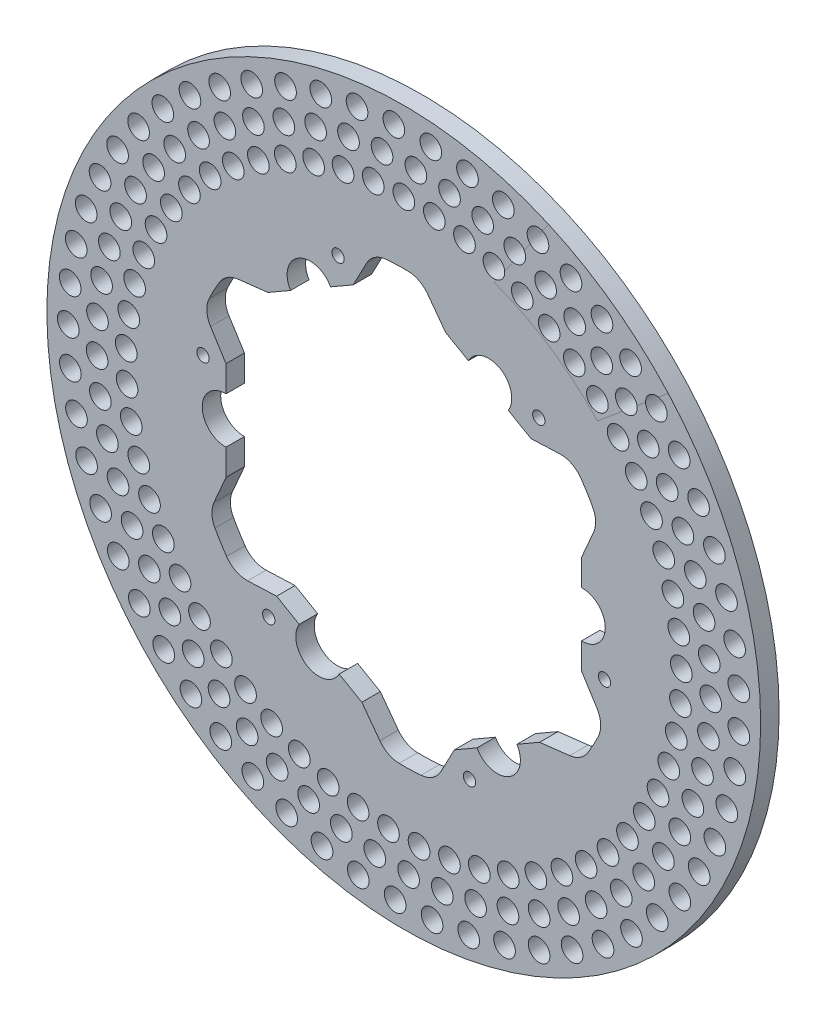
from build123d import *

# Parameters (mm, degrees)
SKETCH1_R           = 92.075
BOSS_EXTRUDE1_DEPTH = 4.7625
FILLET1_R           = 6.35
SKETCH4_R           = 1.5875
CUT_EXTRUDE1_DEPTH  = 131.30077765
SKETCH5_R           = 2.794
CUT_EXTRUDE2_DEPTH  = 131.30077765
CIRPATTERN1_COUNT   = 57


with BuildPart() as part:
    # Sketch1 → Boss-Extrude1 (new body)
    with BuildSketch(Plane.XY):
        with Locations(Location((0, 0, 0), (0, 0, 180))):
            Circle(SKETCH1_R)
        with BuildLine():
            Line((-45.8597, 4.659861673), (-45.8597, 11.409392412))
            Line((-45.8597, 11.409392412), (-51.623596361, 20.547401417))
            ThreePointArc((-51.623596361, 20.547401417), (-49.007713262, 26.180822124), (-45.779418198, 31.487081093))
            Line((-45.779418198, 31.487081093), (-35.046071586, 32.720361416))
            Line((-35.046071586, 32.720361416), (-29.200806502, 36.095126785))
            ThreePointArc((-29.200806502, 36.095126785), (-27.113011458, 44.379898214), (-18.894291413, 42.045596046))
            Line((-18.894291413, 42.045596046), (-13.04902633, 45.420361416))
            Line((-13.04902633, 45.420361416), (-8.017226572, 54.981046592))
            ThreePointArc((-8.017226572, 54.981046592), (-1.830599579, 55.532335728), (4.378903018, 55.389679676))
            Line((4.378903018, 55.389679676), (10.813628414, 46.710969004))
            Line((10.813628414, 46.710969004), (16.658893498, 43.336203635))
            ThreePointArc((16.658893498, 43.336203635), (24.877613542, 45.670505803), (26.965408587, 37.385734374))
            Line((26.965408587, 37.385734374), (32.81067367, 34.010969004))
            Line((32.81067367, 34.010969004), (43.606369789, 34.433645175))
            ThreePointArc((43.606369789, 34.433645175), (47.177113682, 29.351513604), (50.158321216, 23.902598583))
            Line((50.158321216, 23.902598583), (45.8597, 13.990607588))
            Line((45.8597, 13.990607588), (45.8597, 7.241076849))
            ThreePointArc((45.8597, 7.241076849), (51.990625, 1.290607588), (45.8597, -4.659861673))
            Line((45.8597, -4.659861673), (45.8597, -11.409392412))
            Line((45.8597, -11.409392412), (51.623596361, -20.547401417))
            ThreePointArc((51.623596361, -20.547401417), (49.007713262, -26.180822124), (45.779418198, -31.487081093))
            Line((45.779418198, -31.487081093), (35.046071586, -32.720361416))
            Line((35.046071586, -32.720361416), (29.200806502, -36.095126785))
            ThreePointArc((29.200806502, -36.095126785), (27.113011458, -44.379898214), (18.894291413, -42.045596046))
            Line((18.894291413, -42.045596046), (13.04902633, -45.420361416))
            Line((13.04902633, -45.420361416), (8.017226572, -54.981046592))
            ThreePointArc((8.017226572, -54.981046592), (1.830599579, -55.532335728), (-4.378903018, -55.389679676))
            Line((-4.378903018, -55.389679676), (-10.813628414, -46.710969004))
            Line((-10.813628414, -46.710969004), (-16.658893498, -43.336203635))
            ThreePointArc((-16.658893498, -43.336203635), (-24.877613542, -45.670505803), (-26.965408587, -37.385734374))
            Line((-26.965408587, -37.385734374), (-32.81067367, -34.010969004))
            Line((-32.81067367, -34.010969004), (-43.606369789, -34.433645175))
            ThreePointArc((-43.606369789, -34.433645175), (-47.177113682, -29.351513604), (-50.158321216, -23.902598583))
            Line((-50.158321216, -23.902598583), (-45.8597, -13.990607588))
            Line((-45.8597, -13.990607588), (-45.8597, -7.241076849))
            ThreePointArc((-45.8597, -7.241076849), (-51.990625, -1.290607588), (-45.8597, 4.659861673))
        make_face(mode=Mode.SUBTRACT)
    extrude(amount=BOSS_EXTRUDE1_DEPTH)

    # Fillet1
    fillet1_edges = [part.edges().sort_by_distance(p)[0] for p in [
        (-43.606369789, -34.433645175, 2.38125),
        (-4.378903018, -55.389679676, 2.38125),
        (8.017226572, -54.981046592, 2.38125),
        (45.779418198, -31.487081093, 2.38125),
        (51.623596361, -20.547401417, 2.38125),
        (50.158321216, 23.902598583, 2.38125),
        (43.606369789, 34.433645175, 2.38125),
        (4.378903018, 55.389679676, 2.38125),
        (-8.017226572, 54.981046592, 2.38125),
        (-45.779418198, 31.487081093, 2.38125),
        (-51.623596361, 20.547401417, 2.38125),
        (-50.158321216, -23.902598583, 2.38125),
    ]]
    fillet(fillet1_edges, radius=FILLET1_R)

    # Sketch4 → Cut-Extrude1 (cut, through all)
    with BuildSketch(Plane.XY.offset(4.7625)):
        with Locations((-16.953011458, 50.011322779)):
            Circle(SKETCH4_R)
        with Locations((34.834570274, 39.687399983)):
            Circle(SKETCH4_R)
        with Locations((51.787581732, -10.323922796)):
            Circle(SKETCH4_R)
        with Locations((16.953011458, -50.011322779)):
            Circle(SKETCH4_R)
        with Locations((-34.834570274, -39.687399983)):
            Circle(SKETCH4_R)
        with Locations((-51.787581732, 10.323922796)):
            Circle(SKETCH4_R)
    extrude(amount=-CUT_EXTRUDE1_DEPTH, mode=Mode.SUBTRACT)

    # Sketch5 → Cut-Extrude2 (cut, through all)
    with BuildSketch(Plane.XY.offset(4.7625)):
        with Locations((0, 71.628)):
            Circle(SKETCH5_R)
        with Locations((3.122342165, 79.132356295)):
            Circle(SKETCH5_R)
        with Locations((6.987158871, 86.282711239)):
            Circle(SKETCH5_R)
    cut_extrude2 = extrude(amount=-CUT_EXTRUDE2_DEPTH, mode=Mode.SUBTRACT)

    # CirPattern1: Cut-Extrude2 ×57 about axis
    cirpattern1_axis = Axis((0, 0, 0), (0, 0, 1))
    for i in range(1, CIRPATTERN1_COUNT):
        add(cut_extrude2.rotate(cirpattern1_axis, i * 360 / CIRPATTERN1_COUNT), mode=Mode.SUBTRACT)


solid = part.part
